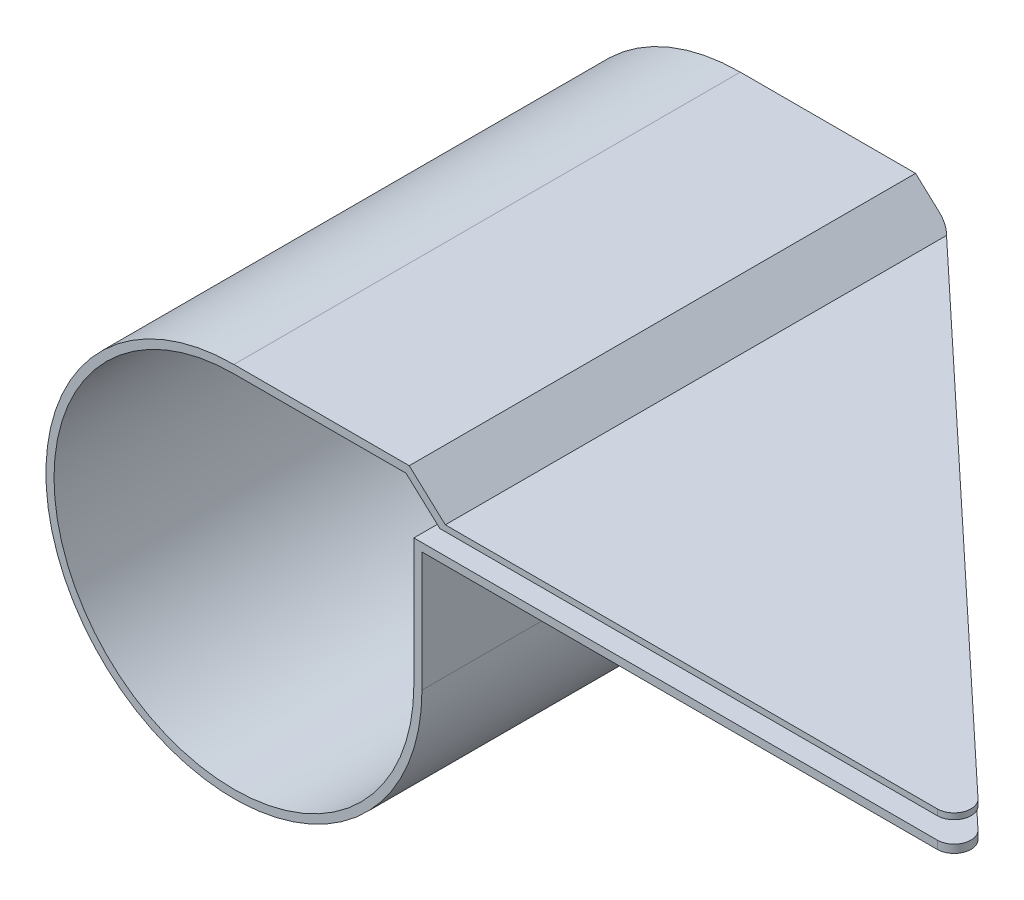
from build123d import *

# Parameters (mm, degrees)
BOSS_EXTRUDE1_DEPTH = 76.2
CUT_EXTRUDE1_DEPTH  = 144.369655065
FILLET1_R           = 2.54


with BuildPart() as part:
    # Sketch2 → Boss-Extrude1 (new body)
    with BuildSketch(Plane.XY):
        Polygon((31.81322426, 23.302810647), (30.988, 24.061604353), (30.988, 22.40534), (112.268, 22.40534), (112.268, 23.302810647), align=None)
        with BuildLine():
            Line((30.988, 22.40534), (30.988, 24.061604353))
            Line((30.988, 24.061604353), (26.38332828, 28.2956))
            Line((26.38332828, 28.2956), (0, 28.2956))
            ThreePointArc((0, 28.2956), (-20.008010638, -20.008010638), (28.2956, 0))
            Line((28.2956, 0), (28.2956, 18.01114))
            Line((28.2956, 18.01114), (112.268, 18.01114))
            Line((112.268, 18.01114), (112.268, 19.23034))
            Line((112.268, 19.23034), (30.988, 19.23034))
            Line((30.988, 19.23034), (27.0764, 19.23034))
            Line((27.0764, 19.23034), (27.0764, 0))
            ThreePointArc((27.0764, 0), (-19.14590605, -19.14590605), (0, 27.0764))
            Line((0, 27.0764), (25.908, 27.0764))
            Line((25.908, 27.0764), (30.988, 22.40534))
        make_face()
    extrude(amount=BOSS_EXTRUDE1_DEPTH)

    # Sketch3 → Cut-Extrude1 (cut, through all)
    with BuildSketch(Plane.XZ.offset(-18.01114)):
        Polygon((112.268, 76.2), (30.988, 0), (112.268, 0), align=None)
    extrude(amount=-CUT_EXTRUDE1_DEPTH, mode=Mode.SUBTRACT)

    # Fillet1
    fillet1_edges = [part.edges().sort_by_distance(p)[0] for p in [
        (112.268, 18.62074, 76.2),
        (30.988, 18.62074, 0),
        (30.988, 23.233472177, 0),
        (112.268, 22.854075323, 76.2),
    ]]
    fillet(fillet1_edges, radius=FILLET1_R)


solid = part.part
